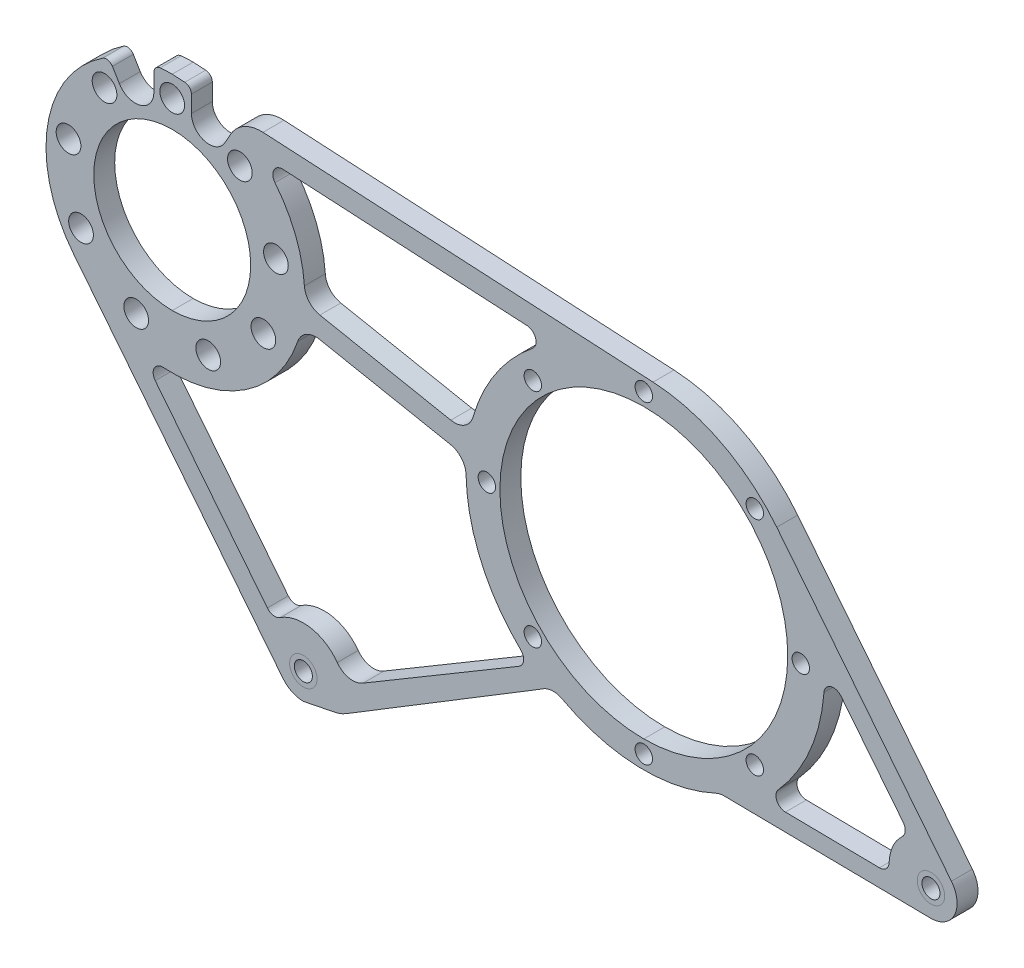
from build123d import *

# Parameters (mm, degrees)
SKETCH1_R               = 3.29946
SKETCH1_R_2             = 28.575
SKETCH1_R_3             = 52.4256
BOSS_EXTRUDE1_DEPTH     = 7.62
CUT_EXTRUDE1_DEPTH      = 314.319493614
CUT_EXTRUDE1_DEPTH_BACK = 314.319493614
SKETCH2_R               = 4.49961
SKETCH2_R_2             = 3.175
CUT_EXTRUDE2_DEPTH      = 314.319493614
CUT_EXTRUDE2_DEPTH_BACK = 314.319493614
FILLET2_R               = 12.7
CUT_EXTRUDE3_DEPTH      = 314.319493614
CUT_EXTRUDE3_DEPTH_BACK = 314.319493614
FILLET3_R               = 2.54
FILLET4_R               = 12.7


with BuildPart() as part:
    # Sketch1 → Boss-Extrude1 (new body)
    with BuildSketch(Plane.XY):
        with BuildLine():
            ThreePointArc((40.310707788, -124.394878894), (43.625834707, -127.040890072), (47.760987503, -127.985322704))
            Line((47.760987503, -127.985322704), (276.360987503, -82.143687357))
            ThreePointArc((276.360987503, -82.143687357), (284.941554871, -76.753840153), (283.811267218, -66.684131167))
            Line((283.811267218, -66.684131167), (220.199398147, 13.174615234))
            ThreePointArc((220.199398147, 13.174615234), (200.160512587, 29.620750083), (175.144631834, 36.420602736))
            Line((175.144631834, 36.420602736), (0, 45.974))
            ThreePointArc((0, 45.974), (-41.415538495, 19.959004162), (-35.960016757, -28.644124543))
            Line((-35.960016757, -28.644124543), (40.310707788, -124.394878894))
        make_face()
        with Locations((47.760987503, -118.460322704)):
            Circle(SKETCH1_R, mode=Mode.SUBTRACT)
        with Locations((276.360987503, -72.618687357)):
            Circle(SKETCH1_R, mode=Mode.SUBTRACT)
        Circle(SKETCH1_R_2, mode=Mode.SUBTRACT)
        with Locations((171.77258, -25.4)):
            Circle(SKETCH1_R_3, mode=Mode.SUBTRACT)
    extrude(amount=BOSS_EXTRUDE1_DEPTH)

    # Sketch2 → Cut-Extrude1 (cut, two sides: drawn at the far end of the back side and taken through both)
    with BuildSketch(Plane.XY.offset(7.62).offset(-CUT_EXTRUDE1_DEPTH_BACK)):
        with Locations((0, 38.354)):
            Circle(SKETCH2_R)
        with Locations((171.77258, 31.76905)):
            Circle(SKETCH2_R_2)
        with Locations((24.653475982, 29.380868571)):
            Circle(SKETCH2_R)
        with Locations((37.771316559, 6.660102206)):
            Circle(SKETCH2_R)
        with Locations((33.215538337, -19.177)):
            Circle(SKETCH2_R)
        with Locations((13.117840577, -36.040970778)):
            Circle(SKETCH2_R)
        with Locations((-13.117840577, -36.040970778)):
            Circle(SKETCH2_R)
        with Locations((-33.215538337, -19.177)):
            Circle(SKETCH2_R)
        with Locations((-37.771316559, 6.660102206)):
            Circle(SKETCH2_R)
        with Locations((-24.653475982, 29.380868571)):
            Circle(SKETCH2_R)
        with Locations((212.197202929, 15.024622929)):
            Circle(SKETCH2_R_2)
        with Locations((228.94163, -25.4)):
            Circle(SKETCH2_R_2)
        with Locations((212.197202929, -65.824622929)):
            Circle(SKETCH2_R_2)
        with Locations((171.77258, -82.56905)):
            Circle(SKETCH2_R_2)
        with Locations((131.347957071, -65.824622929)):
            Circle(SKETCH2_R_2)
        with Locations((114.60353, -25.4)):
            Circle(SKETCH2_R_2)
        with Locations((131.347957071, 15.024622929)):
            Circle(SKETCH2_R_2)
    extrude(amount=CUT_EXTRUDE1_DEPTH + CUT_EXTRUDE1_DEPTH_BACK, mode=Mode.SUBTRACT)

    # Sketch5 → Cut-Extrude2 (cut, two sides: drawn at the far end of the back side and taken through both)
    with BuildSketch(Plane(origin=(0, 0, 0), x_dir=(-1, 0, 0), z_dir=(0, 0, -1)).offset(-CUT_EXTRUDE2_DEPTH_BACK)):
        with BuildLine():
            Line((-243.589980451, -28.420218982), (-266.229006424, -56.84139667))
            ThreePointArc((-266.229006424, -56.84139667), (-266.978290112, -59.255128799), (-265.89655065, -61.539284785))
            ThreePointArc((-265.89655065, -61.539284785), (-262.4556706, -66.381719999), (-261.127541325, -72.171789682))
            ThreePointArc((-261.127541325, -72.171789682), (-260.057201806, -74.581862154), (-257.603993865, -75.549253906))
            Line((-257.603993865, -75.549253906), (-223.345463701, -75.103791216))
            ThreePointArc((-223.345463701, -75.103791216), (-220.204512197, -73.023273129), (-220.7984065, -69.302867047))
            ThreePointArc((-220.7984065, -69.302867047), (-232.320070073, -51.187493962), (-237.398113791, -30.327749345))
            ThreePointArc((-237.398113791, -30.327749345), (-239.843636661, -27.262743932), (-243.589980451, -28.420218982))
        make_face()
        with BuildLine():
            Line((-40.310932114, 36.143882278), (-129.2329494, 31.293563157))
            ThreePointArc((-129.2329494, 31.293563157), (-132.356283928, 28.883803437), (-131.222021432, 25.105495738))
            ThreePointArc((-131.222021432, 25.105495738), (-117.850437324, 10.482522615), (-109.525506814, -7.498749212))
            ThreePointArc((-109.525506814, -7.498749212), (-106.457644943, -11.526726906), (-101.474520552, -12.423862382))
            Line((-101.474520552, -12.423862382), (-53.780148142, -3.1149948))
            ThreePointArc((-53.780148142, -3.1149948), (-49.880239941, -0.880376651), (-48.149245066, 3.267690247))
            ThreePointArc((-48.149245066, 3.267690247), (-44.896236095, 17.701852573), (-37.423009556, 30.472052043))
            ThreePointArc((-37.423009556, 30.472052043), (-37.020434548, 34.248166986), (-40.310932114, 36.143882278))
        make_face()
        with BuildLine():
            ThreePointArc((-39.302161905, -105.783340827), (-36.833952554, -106.326913666), (-34.648894538, -105.056854494))
            Line((-34.648894538, -105.056854494), (6.186568412, -53.791753696))
            ThreePointArc((6.186568412, -53.791753696), (6.547130169, -50.008783233), (3.231709617, -48.151673418))
            ThreePointArc((3.231709617, -48.151673418), (-26.797926427, -40.13600303), (-45.712365207, -15.472791189))
            ThreePointArc((-45.712365207, -15.472791189), (-48.822624125, -11.670903611), (-53.666695197, -10.856633909))
            Line((-53.666695197, -10.856633909), (-101.374019125, -20.168029335))
            ThreePointArc((-101.374019125, -20.168029335), (-105.376863014, -22.522014289), (-107.019164045, -26.865613222))
            ThreePointArc((-107.019164045, -26.865613222), (-112.485034835, -51.479491719), (-126.935132299, -72.141375501))
            ThreePointArc((-126.935132299, -72.141375501), (-127.983236253, -75.050116103), (-126.302243919, -77.645026229))
            Line((-126.302243919, -77.645026229), (-69.528196733, -111.340573769))
            ThreePointArc((-69.528196733, -111.340573769), (-64.463868617, -112.307803939), (-60.115626386, -109.537290816))
            ThreePointArc((-60.115626386, -109.537290816), (-50.466052275, -103.462315351), (-39.302161905, -105.783340827))
        make_face()
        with BuildLine():
            Line((-276.360987503, -82.143687357), (-61.405360183, -125.24918816))
            Line((-61.405360183, -125.24918816), (-134.620271919, -80.665110684))
            ThreePointArc((-134.620271919, -80.665110684), (-138.295422572, -79.292203946), (-142.130961394, -80.116974938))
            ThreePointArc((-142.130961394, -80.116974938), (-169.881448075, -87.601258187), (-198.035354318, -81.816660528))
            ThreePointArc((-198.035354318, -81.816660528), (-199.517976868, -81.319553012), (-201.07403482, -81.164733259))
            Line((-201.07403482, -81.164733259), (-276.360987503, -82.143687357))
        make_face()
    extrude(amount=CUT_EXTRUDE2_DEPTH + CUT_EXTRUDE2_DEPTH_BACK, mode=Mode.SUBTRACT)

    # Fillet2
    fillet2_edges = [part.edges().sort_by_distance(p)[0] for p in [
        (61.405360183, -125.24918816, 3.81),
    ]]
    fillet(fillet2_edges, radius=FILLET2_R)

    # Sketch6 → Cut-Extrude3 (cut, two sides: drawn at the far end of the back side and taken through both)
    with BuildSketch(Plane(origin=(0, 0, 0), x_dir=(-1, 0, 0), z_dir=(0, 0, -1)).offset(-CUT_EXTRUDE3_DEPTH_BACK)):
        with BuildLine():
            Line((-19.149599026, 33.871202127), (-25.180470346, 44.600512078))
            Line((-25.180470346, 44.600512078), (-6.983635222, 45.593072301))
            Line((-6.983635222, 45.593072301), (-6.983635222, 37.0560801))
            ThreePointArc((-6.983635222, 37.0560801), (-11.837393988, 30.76811296), (-19.149599026, 33.871202127))
        make_face()
        with BuildLine():
            Line((6.694264778, 36.870190043), (6.694264778, 45.484013621))
            ThreePointArc((6.694264778, 45.484013621), (15.174774423, 43.397406572), (23.107677895, 39.744734221))
            Line((23.107677895, 39.744734221), (19.260113276, 33.371320679))
            ThreePointArc((19.260113276, 33.371320679), (11.648320448, 30.348253304), (6.694264778, 36.870190043))
        make_face()
    extrude(amount=CUT_EXTRUDE3_DEPTH + CUT_EXTRUDE3_DEPTH_BACK, mode=Mode.SUBTRACT)

    # Fillet3
    fillet3_edges = [part.edges().sort_by_distance(p)[0] for p in [
        (-6.694264778, 45.484013621, 3.81),
        (6.983635222, 45.593072301, 3.81),
        (-23.107677895, 39.744734221, 3.81),
    ]]
    fillet(fillet3_edges, radius=FILLET3_R)

    # Fillet4
    fillet4_edges = [part.edges().sort_by_distance(p)[0] for p in [
        (25.180470346, 44.600512078, 3.81),
    ]]
    fillet(fillet4_edges, radius=FILLET4_R)


solid = part.part
